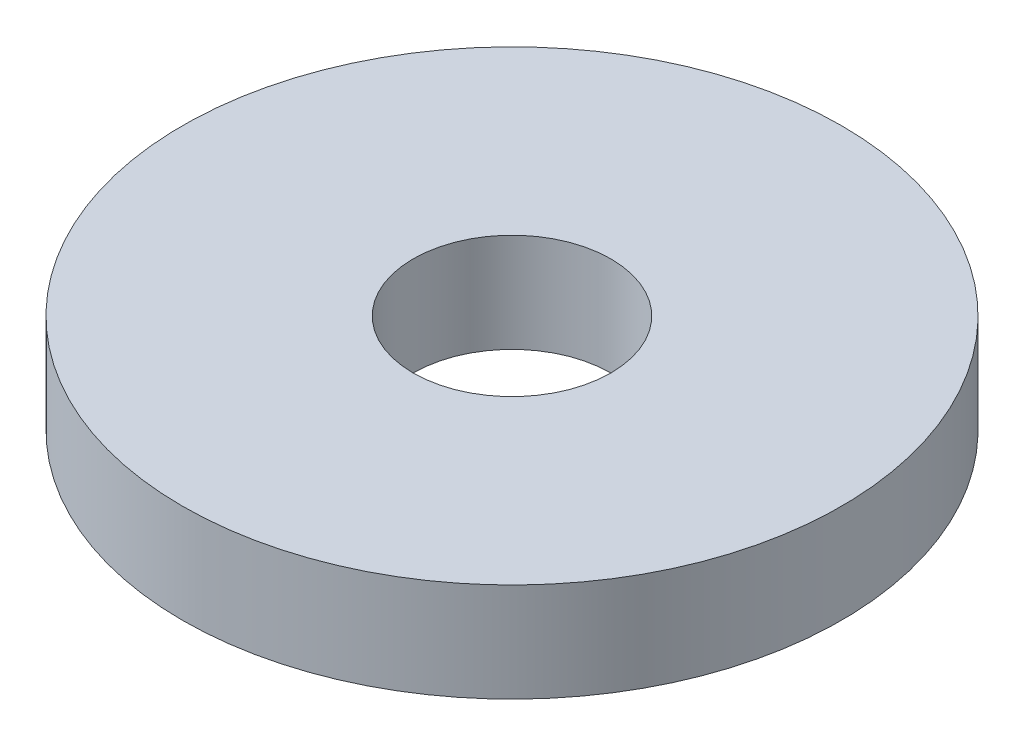
from build123d import *

# Parameters (mm, degrees)
ESQUISSE1_R        = 5
ESQUISSE1_R_2      = 1.5
BOSS_EXTRU_1_DEPTH = 1.5


with BuildPart() as part:
    # Esquisse1 → Boss.-Extru.1 (new body)
    with BuildSketch(Plane(origin=(0, 0, 0), x_dir=(1, 0, 0), z_dir=(0, 1, 0))):
        with Locations(Location((0, 0, 0), (0, 0, 270))):
            Circle(ESQUISSE1_R)
        with Locations(Location((0, 0, 0), (0, 0, 270))):
            Circle(ESQUISSE1_R_2, mode=Mode.SUBTRACT)
    extrude(amount=BOSS_EXTRU_1_DEPTH)


solid = part.part
